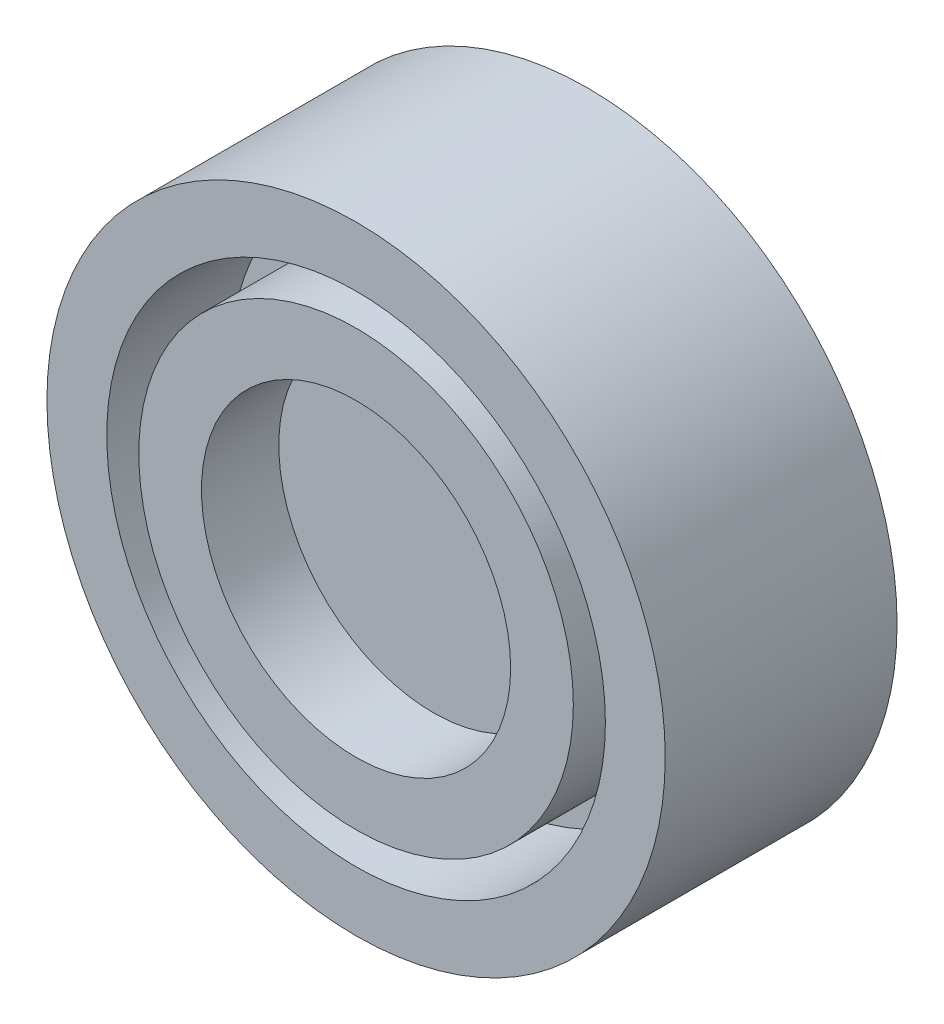
from build123d import *

# Parameters (mm, degrees)
SKETCH1_R           = 20
BOSS_EXTRUDE1_DEPTH = 15
SKETCH2_R           = 10
CUT_EXTRUDE1_DEPTH  = 5
SKETCH3_R           = 16.129464202
SKETCH3_R_2         = 14.05591846
CUT_EXTRUDE2_DEPTH  = 8


with BuildPart() as part:
    # Sketch1 → Boss-Extrude1 (new body)
    with BuildSketch(Plane.XY):
        Circle(SKETCH1_R)
    extrude(amount=BOSS_EXTRUDE1_DEPTH)

    # Sketch2 → Cut-Extrude1 (cut)
    with BuildSketch(Plane.XY.offset(15)):
        Circle(SKETCH2_R)
    extrude(amount=-CUT_EXTRUDE1_DEPTH, mode=Mode.SUBTRACT)

    # Sketch3 → Cut-Extrude2 (cut)
    with BuildSketch(Plane.XY.offset(15)):
        Circle(SKETCH3_R)
        Circle(SKETCH3_R_2, mode=Mode.SUBTRACT)
    extrude(amount=-CUT_EXTRUDE2_DEPTH, mode=Mode.SUBTRACT)


solid = part.part
